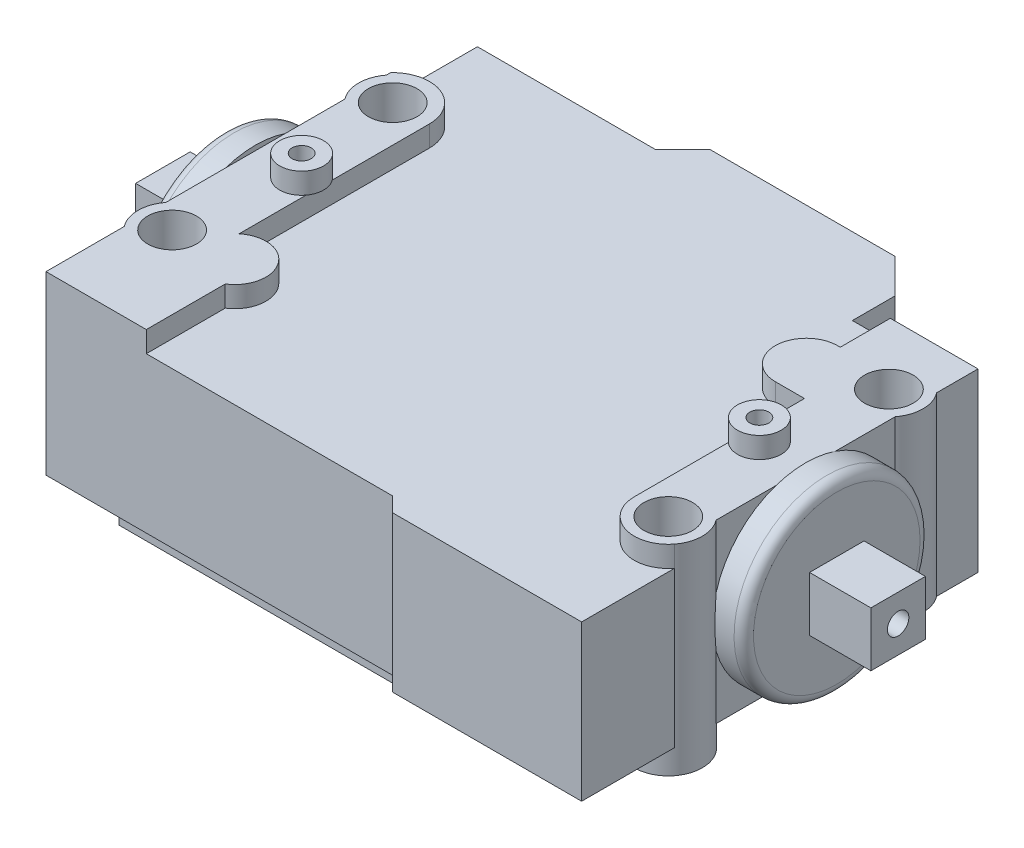
from build123d import *
from build123d.topology import SkipClean

# Parameters (mm, degrees)
SKETCH1_W            = 5.6
SKETCH1_H            = 5.6
SKETCH1_R            = 1.1
BOSS_EXTRUDE1_DEPTH  = 37.75
BOSS_EXTRUDE2_DEPTH  = 9.05
SKETCH4_R            = 3.5
BOSS_EXTRUDE4_DEPTH  = 18.1
SKETCH5_R            = 3.5
BOSS_EXTRUDE5_DEPTH  = 2.5
SKETCH6_R            = 2.5
CUT_EXTRUDE1_DEPTH   = 19.2
SKETCH7_R            = 1.35
CUT_EXTRUDE2_DEPTH   = 50.488004
BOSS_EXTRUDE6_DEPTH  = 1.2
SKETCH3_R            = 9.55
BOSS_EXTRUDE3_DEPTH  = 3.2
FILLET1_R            = 1
FILLET1_OF_MIRROR1_R = 1
SKETCH9_R            = 2.25
SKETCH9_R_2          = 0.975
BOSS_EXTRUDE7_DEPTH  = 2.15
CUT_EXTRUDE3_DEPTH   = 2.15
CUT_EXTRUDE4_START   = -4.064
SKETCH11_R           = 0.975
CUT_EXTRUDE4_DEPTH   = 4.064


with BuildPart() as part:
    # Sketch1 → Boss-Extrude1 (new, symmetric)
    with BuildSketch(Plane(origin=(0, 0, 0), x_dir=(0, 0, -1), z_dir=(1, 0, 0))):
        Rectangle(SKETCH1_W, SKETCH1_H)
        Circle(SKETCH1_R, mode=Mode.SUBTRACT)
    extrude(amount=BOSS_EXTRUDE1_DEPTH, both=True)

    # Sketch2 → Boss-Extrude2 (add, symmetric)
    with BuildSketch(Plane(origin=(0, 0, 0), x_dir=(1, 0, 0), z_dir=(0, 1, 0))):
        Polygon((8.85, -23), (28.25, -23), (28.25, 17.7), (15.35, 17.7), (15.35, 22.1), (11.85, 25.6), (-7.15, 25.6), (-9.95, 22.8), (-28.25, 22.8), (-28.25, -21.5), (7.35, -21.5), align=None)
    extrude(amount=BOSS_EXTRUDE2_DEPTH, both=True)

    # Sketch4 → Boss-Extrude4 (add)
    with BuildSketch(Plane(origin=(0, 9.05, 0), x_dir=(1, 0, 0), z_dir=(0, 1, 0))):
        with Locations((-25.475, 11.325)):
            Circle(SKETCH4_R)
        with Locations((-25.475, -11.325)):
            Circle(SKETCH4_R)
        with Locations((25.475, -11.325)):
            Circle(SKETCH4_R)
        with Locations((25.475, 11.325)):
            Circle(SKETCH4_R)
    extrude(amount=-BOSS_EXTRUDE4_DEPTH)

    # Sketch5 → Boss-Extrude5 (add)
    with SkipClean():  # the faces are left unmerged after this step: merging them gives an invalid solid
        with BuildSketch(Plane.XZ.offset(9.05)):
            with Locations(Location((-25.475, 11.325, 0), (0, 0, 142.453323))):
                Circle(SKETCH5_R)
            with Locations(Location((25.475, 11.325, 0), (0, 0, 37.546677))):
                Circle(SKETCH5_R)
        extrude(amount=BOSS_EXTRUDE5_DEPTH)

    # Sketch6 → Cut-Extrude1 (cut)
    with SkipClean():  # the faces are left unmerged after this step: merging them gives an invalid solid
        with BuildSketch(Plane(origin=(0, 9.05, 0), x_dir=(1, 0, 0), z_dir=(0, 1, 0))):
            with Locations(Location((-25.475, 11.325, 0), (0, 0, 270))):
                Circle(SKETCH6_R)
            with Locations(Location((25.475, 11.325, 0), (0, 0, 270))):
                Circle(SKETCH6_R)
            with Locations(Location((25.475, -11.325, 0), (0, 0, 270))):
                Circle(SKETCH6_R)
            with Locations(Location((-25.475, -11.325, 0), (0, 0, 270))):
                Circle(SKETCH6_R)
        extrude(amount=-CUT_EXTRUDE1_DEPTH, mode=Mode.SUBTRACT)

    # Sketch7 → Cut-Extrude2 (cut, through all)
    with SkipClean():  # the faces are left unmerged after this step: merging them gives an invalid solid
        with BuildSketch(Plane(origin=(0, -10.15, 0), x_dir=(1, 0, 0), z_dir=(0, 1, 0))):
            with Locations(Location((-25.475, -11.325, 0), (0, 0, 270))):
                Circle(SKETCH7_R)
            with Locations(Location((25.475, -11.325, 0), (0, 0, 270))):
                Circle(SKETCH7_R)
        extrude(amount=-CUT_EXTRUDE2_DEPTH, mode=Mode.SUBTRACT)

    # Sketch8 → Boss-Extrude6 (add)
    with SkipClean():  # the faces are left unmerged after this step: merging them gives an invalid solid
        with BuildSketch(Plane.XZ.offset(9.05)):
            Polygon((-21.25, 21), (21.25, 21), (21.25, -8.2), (4.797527, -8.2), (4.797527, -21.3), (-21.25, -21.3), align=None)
            Polygon((-19.75, -19.8), (-19.75, 19.5), (19.75, 19.5), (19.75, -6.7), (3.297527, -6.7), (3.297527, -19.8), align=None, mode=Mode.SUBTRACT)
        extrude(amount=BOSS_EXTRUDE6_DEPTH)

    # Sketch3 → Boss-Extrude3 (add)
    with SkipClean():  # the faces are left unmerged after this step: merging them gives an invalid solid
        with BuildSketch(Plane(origin=(28.25, 0, 0), x_dir=(0, 0, -1), z_dir=(1, 0, 0))):
            with Locations(Location((0, 0, 0), (0, 0, 195.736156))):
                Circle(SKETCH3_R)
        boss_extrude3 = extrude(amount=BOSS_EXTRUDE3_DEPTH)

    # Fillet1
    fillet1_edges = [part.edges().sort_by_distance(p)[0] for p in [
        (31.45, 2.590035, -9.192074),
    ]]
    fillet(fillet1_edges, radius=FILLET1_R)

    # Mirror1: Boss-Extrude3 across plane
    add(boss_extrude3.mirror(Plane(origin=(0, 0, 0), x_dir=(0, 0, 1), z_dir=(1, 0, 0))))

    # Fillet1 of Mirror1
    fillet1_of_mirror1_edges = [part.edges().sort_by_distance(p)[0] for p in [
        (-31.45, 2.590035, -9.192074),
    ]]
    fillet(fillet1_of_mirror1_edges, radius=FILLET1_OF_MIRROR1_R)

    # Sketch9 → Boss-Extrude7 (add)
    # profile 1 of 2: a face of its own
    with SkipClean():  # the faces are left unmerged after this step: merging them gives an invalid solid
        with BuildSketch(Plane(origin=(0, 9.05, 0), x_dir=(1, 0, 0), z_dir=(0, 1, 0))):
            with Locations(Location((-23.5, 0, 0), (0, 0, 90))):
                Circle(SKETCH9_R)
            with Locations(Location((-23.5, 0, 0), (0, 0, 90))):
                Circle(SKETCH9_R_2, mode=Mode.SUBTRACT)
        # profile 2 of 2: a face of its own
        with BuildSketch(Plane(origin=(0, 9.05, 0), x_dir=(1, 0, 0), z_dir=(0, 1, 0))):
            with Locations(Location((23.5, 0, 0), (0, 0, 90))):
                Circle(SKETCH9_R)
            with Locations(Location((23.5, 0, 0), (0, 0, 90))):
                Circle(SKETCH9_R_2, mode=Mode.SUBTRACT)
        extrude(amount=BOSS_EXTRUDE7_DEPTH)

    # Sketch10 → Cut-Extrude3 (cut)
    with SkipClean():  # the faces are left unmerged after this step: merging them gives an invalid solid
        with BuildSketch(Plane(origin=(0, 9.05, 0), x_dir=(1, 0, 0), z_dir=(0, 1, 0))):
            with BuildLine():
                Line((-17.95, -34.907673), (-17.95, -13.394974))
                ThreePointArc((-17.95, -13.394974), (-17.079605, -8.818382), (-21.7, -8.22279))
                Line((-21.7, -8.22279), (-21.7, 11.325))
                ThreePointArc((-21.7, 11.325), (-24.101137, 14.841124), (-28.25, 13.884297))
                Line((-28.25, 13.884297), (-28.25, 32.664431))
                Line((-28.25, 32.664431), (19.25, 32.664431))
                Line((19.25, 32.664431), (19.25, 12.545268))
                ThreePointArc((19.25, 12.545268), (15.777961, 9.494733), (18.975, 6.157106))
                Line((18.975, 6.157106), (21.975, 6.157106))
                Line((21.975, 6.157106), (21.975, -11.325))
                ThreePointArc((21.975, -11.325), (24.348612, -14.638797), (28.25, -13.457926))
                Line((28.25, -13.457926), (28.25, -34.907673))
                Line((28.25, -34.907673), (-17.95, -34.907673))
            make_face()
        extrude(amount=-CUT_EXTRUDE3_DEPTH, mode=Mode.SUBTRACT)

    # Sketch11 → Cut-Extrude4 (cut)
    with SkipClean():  # the faces are left unmerged after this step: merging them gives an invalid solid
        with BuildSketch(Plane(origin=(0, 11.2, 0), x_dir=(1, 0, 0), z_dir=(0, 1, 0)).offset(CUT_EXTRUDE4_START)):
            with Locations(Location((-23.5, 0, 0), (0, 0, 90))):
                Circle(SKETCH11_R)
            with Locations(Location((23.5, 0, 0), (0, 0, 90))):
                Circle(SKETCH11_R)
        extrude(amount=CUT_EXTRUDE4_DEPTH, mode=Mode.SUBTRACT)


solid = part.part
